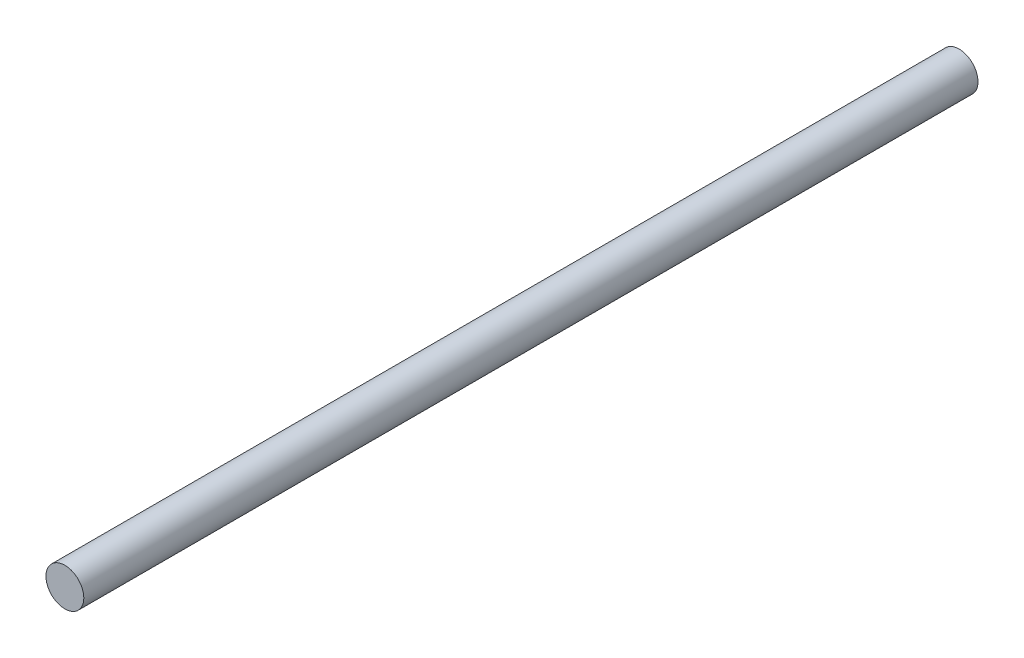
from build123d import *

# Parameters (mm, degrees)
SKETCH_1_R      = 2.75
EXTRUDE_1_DEPTH = 130


with BuildPart() as part:
    # ｽｹｯﾁ1 → ﾎﾞｽ - 押し出し1 (new body)
    with BuildSketch(Plane.XY):
        Circle(SKETCH_1_R)
    extrude(amount=EXTRUDE_1_DEPTH)


solid = part.part
